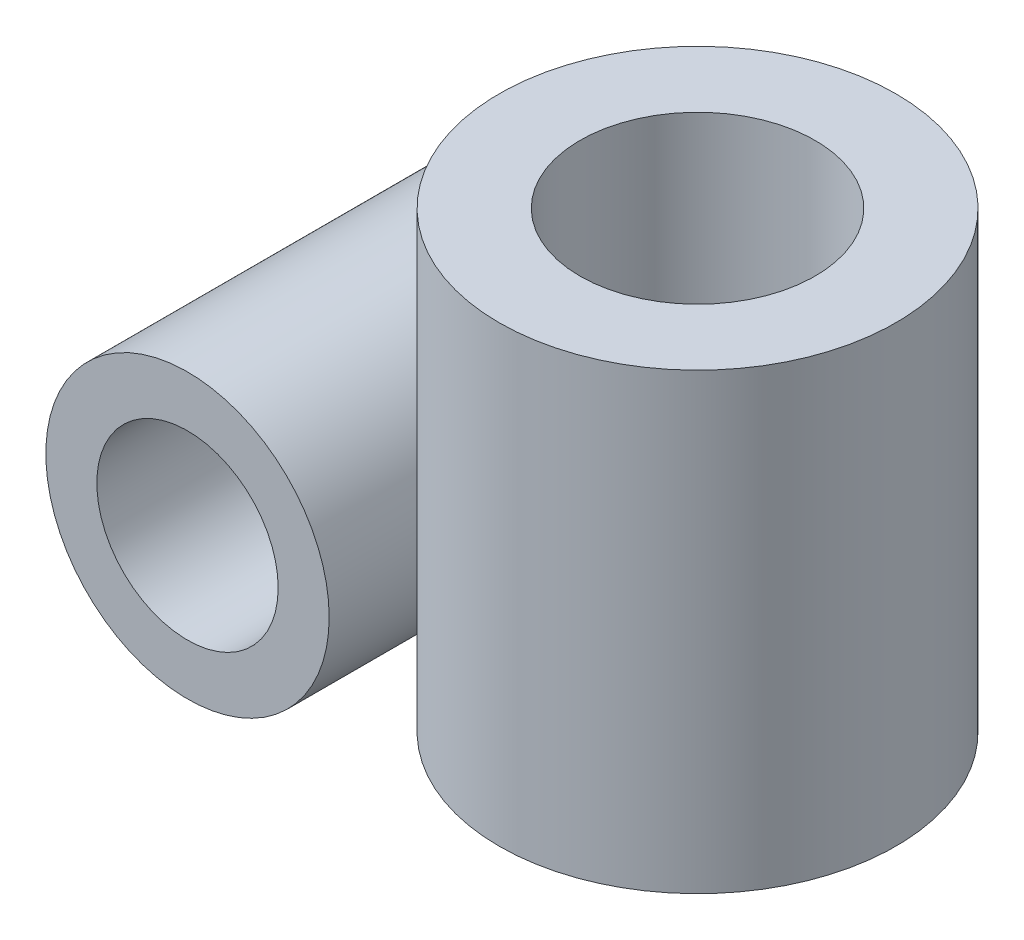
from build123d import *

# Parameters (mm, degrees)
SKETCH3_R               = 7
SKETCH3_R_2             = 4.15
BOSS_EXTRUDE1_DEPTH     = 16
SKETCH4_R               = 5
SKETCH4_R_2             = 3.2
BOSS_EXTRUDE2_DEPTH     = 8
CUT_EXTRUDE1_DEPTH      = 24.345235227
CUT_EXTRUDE1_DEPTH_BACK = 24.345235227
SKETCH4_2_R             = 3.2


with BuildPart() as part:
    # Sketch3 → Boss-Extrude1 (new body)
    with BuildSketch(Plane(origin=(0, 0, 0), x_dir=(1, 0, 0), z_dir=(0, 1, 0))):
        Circle(SKETCH3_R)
        Circle(SKETCH3_R_2, mode=Mode.SUBTRACT)
    extrude(amount=BOSS_EXTRUDE1_DEPTH)

    # Sketch4 → Boss-Extrude2 (add, symmetric)
    with BuildSketch(Plane.XY):
        with Locations((-10, 5)):
            Circle(SKETCH4_R)
        with Locations((-10, 5)):
            Circle(SKETCH4_R_2, mode=Mode.SUBTRACT)
    extrude(amount=BOSS_EXTRUDE2_DEPTH, both=True)

    # Sketch4<2> → Cut-Extrude1 (cut, two sides: drawn at the far end of the back side and taken through both)
    with BuildSketch(Plane.XY.offset(-CUT_EXTRUDE1_DEPTH_BACK)):
        with Locations((-10, 5)):
            Circle(SKETCH4_2_R)
    extrude(amount=CUT_EXTRUDE1_DEPTH + CUT_EXTRUDE1_DEPTH_BACK, mode=Mode.SUBTRACT)


solid = part.part
